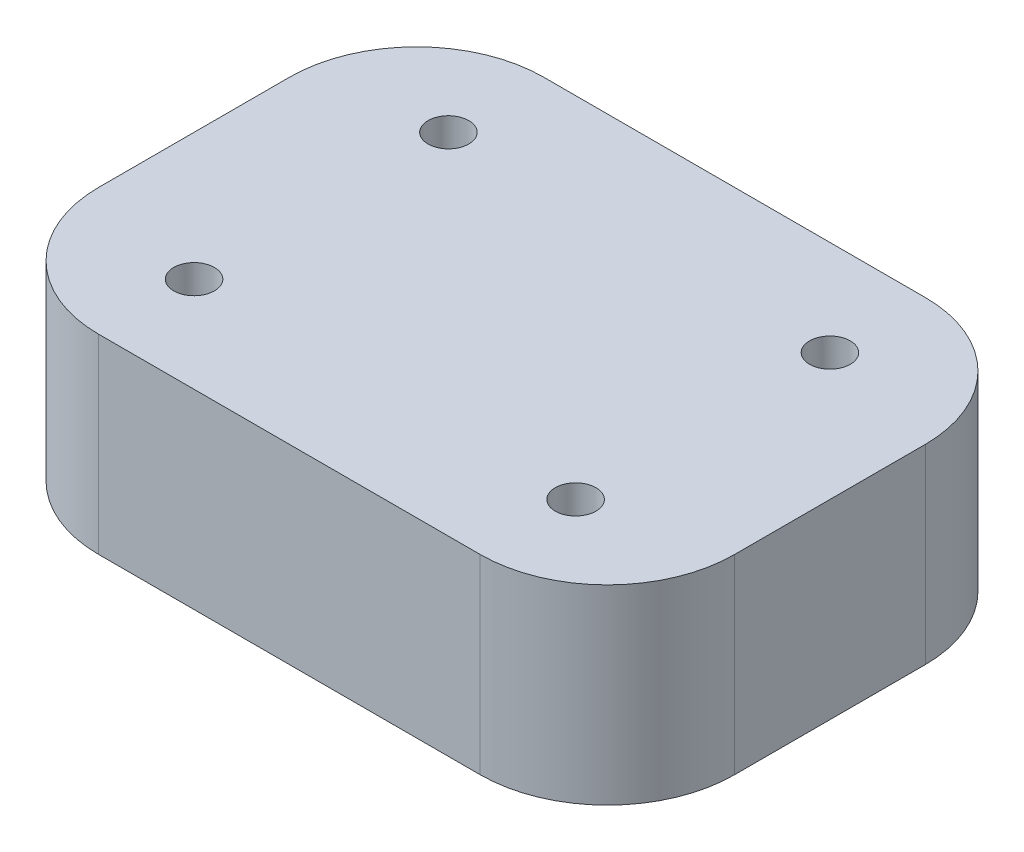
from build123d import *

# Parameters (mm, degrees)
SKETCH1_W           = 50
SKETCH1_H           = 35
SKETCH1_R           = 1.6
BOSS_EXTRUDE1_DEPTH = 15
FILLET1_R           = 10


with BuildPart() as part:
    # Sketch1 → Boss-Extrude1 (new body)
    with BuildSketch(Plane(origin=(0, 0, 0), x_dir=(1, 0, 0), z_dir=(0, 1, 0))):
        with Locations((25, 17.5)):
            Rectangle(SKETCH1_W, SKETCH1_H)
        with Locations(Location((10, 27.5, 0), (0, 0, 270))):
            Circle(SKETCH1_R, mode=Mode.SUBTRACT)
        with Locations(Location((40, 27.5, 0), (0, 0, 270))):
            Circle(SKETCH1_R, mode=Mode.SUBTRACT)
        with Locations(Location((40, 7.5, 0), (0, 0, 90))):
            Circle(SKETCH1_R, mode=Mode.SUBTRACT)
        with Locations(Location((10, 7.5, 0), (0, 0, 90))):
            Circle(SKETCH1_R, mode=Mode.SUBTRACT)
    extrude(amount=BOSS_EXTRUDE1_DEPTH)

    # Fillet1
    fillet1_edges = [part.edges().sort_by_distance(p)[0] for p in [
        (0, 7.5, -35),
        (50, 7.5, -35),
        (50, 7.5, 0),
        (0, 7.5, 0),
    ]]
    fillet(fillet1_edges, radius=FILLET1_R)


solid = part.part
